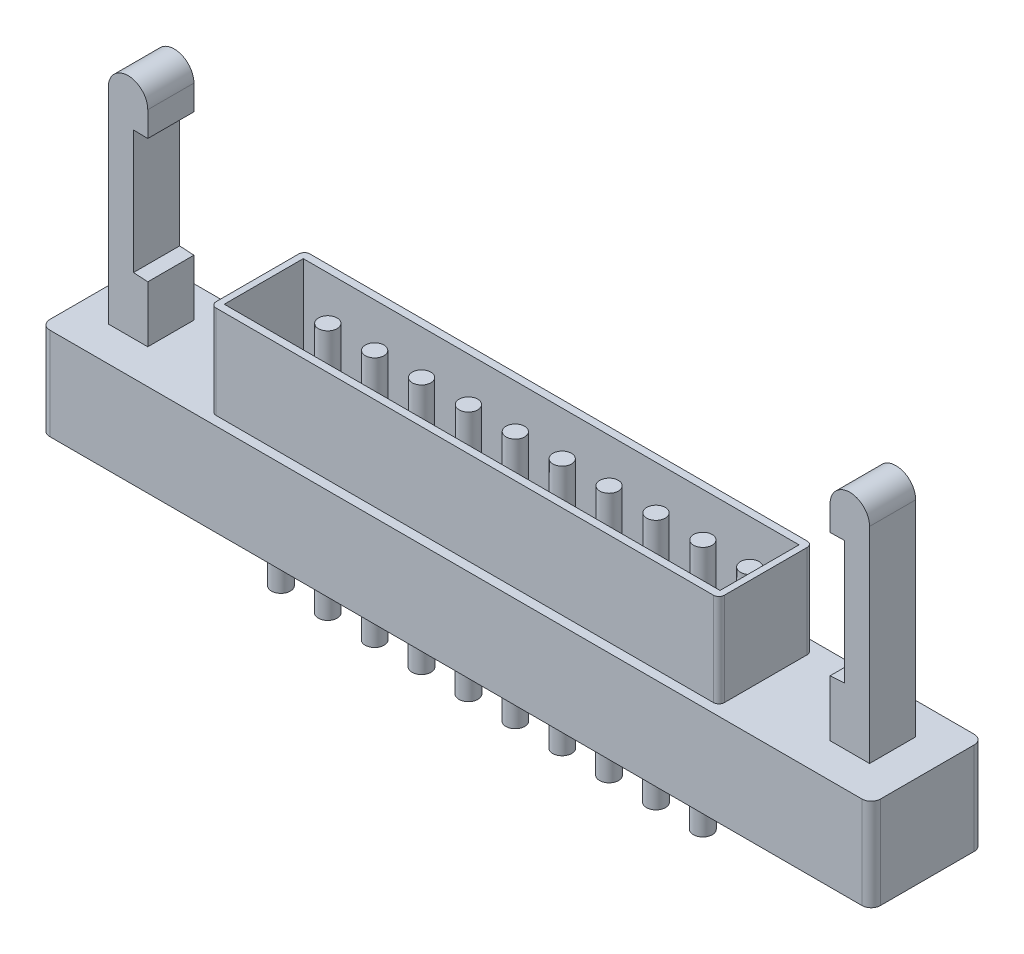
from build123d import *

# Parameters (mm, degrees)
SKETCH_2_W             = 24.08
SKETCH_2_H             = 1
EXTRUDE_1_DEPTH        = 5.08
SKETCH_3_R             = 0.514113779
SKETCH_3_R_2           = 0.502427848
EXTRUDE_2_DEPTH        = 2.5
PATTERN_LINEAR_1_COUNT = 10
PATTERN_LINEAR_1_PITCH = 2.54
SKETCH_4_W             = 30.218019713
SKETCH_4_H             = 8.471214157
CUT_EXTRUDE_1_DEPTH    = 5.08
EXTRUDE_START          = 6
SKETCH_5_R             = 0.514113779
SKETCH_5_R_2           = 0.502427848
EXTRUDE_3_DEPTH        = 6
SKETCH_6_W             = 45
SKETCH_6_H             = 6.08
SKETCH_6_W_2           = 27.54
SKETCH_6_H_2           = 5.08
EXTRUDE_4_DEPTH        = 2.4
SKETCH_7_W             = 27.54
SKETCH_7_H             = 5.08
SKETCH_7_W_2           = 26.85830286
SKETCH_7_H_2           = 4.28
EXTRUDE_6_DEPTH        = 7.5
SKETCH_8_W             = 45
SKETCH_8_H             = 6.08
EXTRUDE_7_DEPTH        = 2.6
EXTRUDE_8_DEPTH        = 1.25
EXTRUDE_8_DEPTH_BACK   = 1.25
EXTRUDE_8_2_DEPTH      = 1.25
EXTRUDE_8_2_DEPTH_BACK = 1.25
FILLET_1_R             = 0.3
FILLET_2_R             = 0.5


with BuildPart() as part:
    # Эскиз2 → Вытянуть1 (new body)
    with BuildSketch(Plane.XY):
        Polygon((0, 0), (27.54, 0), (27.54, 2.54), (27.24, 2.54), (27.24, 3.34), (27.54, 3.34), (27.54, 7.62), (0, 7.62), (0, 3.34), (0.3, 3.34), (0.3, 2.54), (0, 2.54), align=None)
        with Locations((13.77, 5.5)):
            Rectangle(SKETCH_2_W, SKETCH_2_H, mode=Mode.SUBTRACT)
    extrude(amount=EXTRUDE_1_DEPTH)

    # Эскиз3 → Вытянуть2 (add)
    with BuildSketch(Plane.XZ):
        with Locations(Location((2.54, 3.81, 0), (0, 0, 180))):
            Circle(SKETCH_3_R)
        with Locations(Location((2.54, 1.27, 0), (0, 0, 180))):
            Circle(SKETCH_3_R_2)
    extrude_2 = extrude(amount=EXTRUDE_2_DEPTH)

    # Линейный массив1: Вытянуть2 ×10
    with Locations(*[(i * PATTERN_LINEAR_1_PITCH, 0, 0) for i in range(1, PATTERN_LINEAR_1_COUNT)]):
        add(extrude_2)

    # Эскиз4 → Вырез-Вытянуть1 (cut)
    with BuildSketch(Plane(origin=(0, 7.62, 0), x_dir=(-1, 0, 0), z_dir=(0, 1, 0))):
        with Locations((-13.970990144, 2.444099463)):
            Rectangle(SKETCH_4_W, SKETCH_4_H)
    extrude(amount=-CUT_EXTRUDE_1_DEPTH, mode=Mode.SUBTRACT)

    # Эскиз5 → Вытянуть3 (add)
    with BuildSketch(Plane(origin=(0, 2.54, 0), x_dir=(-1, 0, 0), z_dir=(0, 1, 0)).offset(EXTRUDE_START)):
        with Locations((-25.4, 3.81)):
            Circle(SKETCH_5_R)
        with Locations((-22.86, 3.81)):
            Circle(SKETCH_5_R)
        with Locations((-20.32, 3.81)):
            Circle(SKETCH_5_R)
        with Locations((-17.78, 3.81)):
            Circle(SKETCH_5_R)
        with Locations((-15.24, 3.81)):
            Circle(SKETCH_5_R)
        with Locations((-12.7, 3.81)):
            Circle(SKETCH_5_R)
        with Locations((-10.16, 3.81)):
            Circle(SKETCH_5_R)
        with Locations((-7.62, 3.81)):
            Circle(SKETCH_5_R)
        with Locations((-5.08, 3.81)):
            Circle(SKETCH_5_R)
        with Locations((-2.54, 3.81)):
            Circle(SKETCH_5_R)
        with Locations((-2.54, 1.27)):
            Circle(SKETCH_5_R_2)
        with Locations((-5.08, 1.27)):
            Circle(SKETCH_5_R_2)
        with Locations((-7.62, 1.27)):
            Circle(SKETCH_5_R_2)
        with Locations((-10.16, 1.27)):
            Circle(SKETCH_5_R_2)
        with Locations((-12.7, 1.27)):
            Circle(SKETCH_5_R_2)
        with Locations((-15.24, 1.27)):
            Circle(SKETCH_5_R_2)
        with Locations((-17.78, 1.27)):
            Circle(SKETCH_5_R_2)
        with Locations((-20.32, 1.27)):
            Circle(SKETCH_5_R_2)
        with Locations((-22.86, 1.27)):
            Circle(SKETCH_5_R_2)
        with Locations((-25.4, 1.27)):
            Circle(SKETCH_5_R_2)
    extrude(amount=-EXTRUDE_3_DEPTH)

    # Эскиз6 → Вытянуть4 (add)
    with BuildSketch(Plane.XZ):
        with Locations((13.79, 2.54)):
            Rectangle(SKETCH_6_W, SKETCH_6_H)
        with Locations((13.77, 2.54)):
            Rectangle(SKETCH_6_W_2, SKETCH_6_H_2, mode=Mode.SUBTRACT)
    extrude(amount=-EXTRUDE_4_DEPTH)

    # Эскиз7 → Вытянуть6 (add)
    with BuildSketch(Plane(origin=(0, 2.54, 0), x_dir=(-1, 0, 0), z_dir=(0, 1, 0))):
        with Locations((-13.77, 2.54)):
            Rectangle(SKETCH_7_W, SKETCH_7_H)
        with Locations((-13.77084857, 2.54)):
            Rectangle(SKETCH_7_W_2, SKETCH_7_H_2, mode=Mode.SUBTRACT)
    extrude(amount=EXTRUDE_6_DEPTH)

    # Эскиз8 → Вытянуть7 (add)
    with BuildSketch(Plane(origin=(0, 2.4, 0), x_dir=(-1, 0, 0), z_dir=(0, 1, 0))):
        with Locations((-13.79, 2.54)):
            Rectangle(SKETCH_8_W, SKETCH_8_H)
    extrude(amount=EXTRUDE_7_DEPTH)

    # Скругление1
    fillet_1_edges = [part.edges().sort_by_distance(p)[0] for p in [
        (0, 7.52, 0),
        (27.54, 7.52, 0),
        (27.54, 7.52, 5.08),
        (0, 7.52, 5.08),
    ]]
    fillet(fillet_1_edges, radius=FILLET_1_R)

    # Скругление2
    fillet_2_edges = [part.edges().sort_by_distance(p)[0] for p in [
        (-8.71, 2.5, -0.5),
        (-8.71, 2.5, 5.58),
        (36.29, 2.5, 5.58),
        (36.29, 2.5, -0.5),
    ]]
    fillet(fillet_2_edges, radius=FILLET_2_R)


with BuildPart() as body_2:
    # Эскиз9 → Вытянуть8 (new, two sides: drawn at the far end of the back side and taken through both)
    with BuildSketch(Plane.XY.offset(2.54).offset(-EXTRUDE_8_DEPTH_BACK)):
        with BuildLine():
            Line((-6.83024797, 5.080918368), (-4.692476739, 5.080918368))
            Line((-4.692476739, 5.080918368), (-4.692476739, 8.129240677))
            Line((-4.692476739, 8.129240677), (-5.465040968, 8.178558812))
            Line((-5.465040968, 8.178558812), (-5.465040968, 14.867757009))
            Line((-5.465040968, 14.867757009), (-4.692476739, 14.853267577))
            Line((-4.692476739, 14.853267577), (-4.692476739, 16.203451679))
            ThreePointArc((-4.692476739, 16.203451679), (-5.761362355, 17.272337295), (-6.83024797, 16.203451679))
            Line((-6.83024797, 16.203451679), (-6.83024797, 5.080918368))
        make_face()
    extrude(amount=EXTRUDE_8_DEPTH + EXTRUDE_8_DEPTH_BACK)


with BuildPart() as body_3:
    # Эскиз9 → Extrude 8 2 (new, two sides: drawn at the far end of the back side and taken through both)
    with BuildSketch(Plane.XY.offset(2.54).offset(-EXTRUDE_8_2_DEPTH_BACK)):
        with BuildLine():
            Line((32.272476739, 5.080918368), (32.272476739, 8.129240677))
            Line((32.272476739, 8.129240677), (33.045040968, 8.178558812))
            Line((33.045040968, 8.178558812), (33.045040968, 14.867757009))
            Line((33.045040968, 14.867757009), (32.272476739, 14.853267577))
            Line((32.272476739, 14.853267577), (32.272476739, 16.203451679))
            ThreePointArc((32.272476739, 16.203451679), (33.341362355, 17.272337295), (34.41024797, 16.203451679))
            Line((34.41024797, 16.203451679), (34.41024797, 5.080918368))
            Line((34.41024797, 5.080918368), (32.272476739, 5.080918368))
        make_face()
    extrude(amount=EXTRUDE_8_2_DEPTH + EXTRUDE_8_2_DEPTH_BACK)


solid = Compound([part.part, body_2.part, body_3.part])
